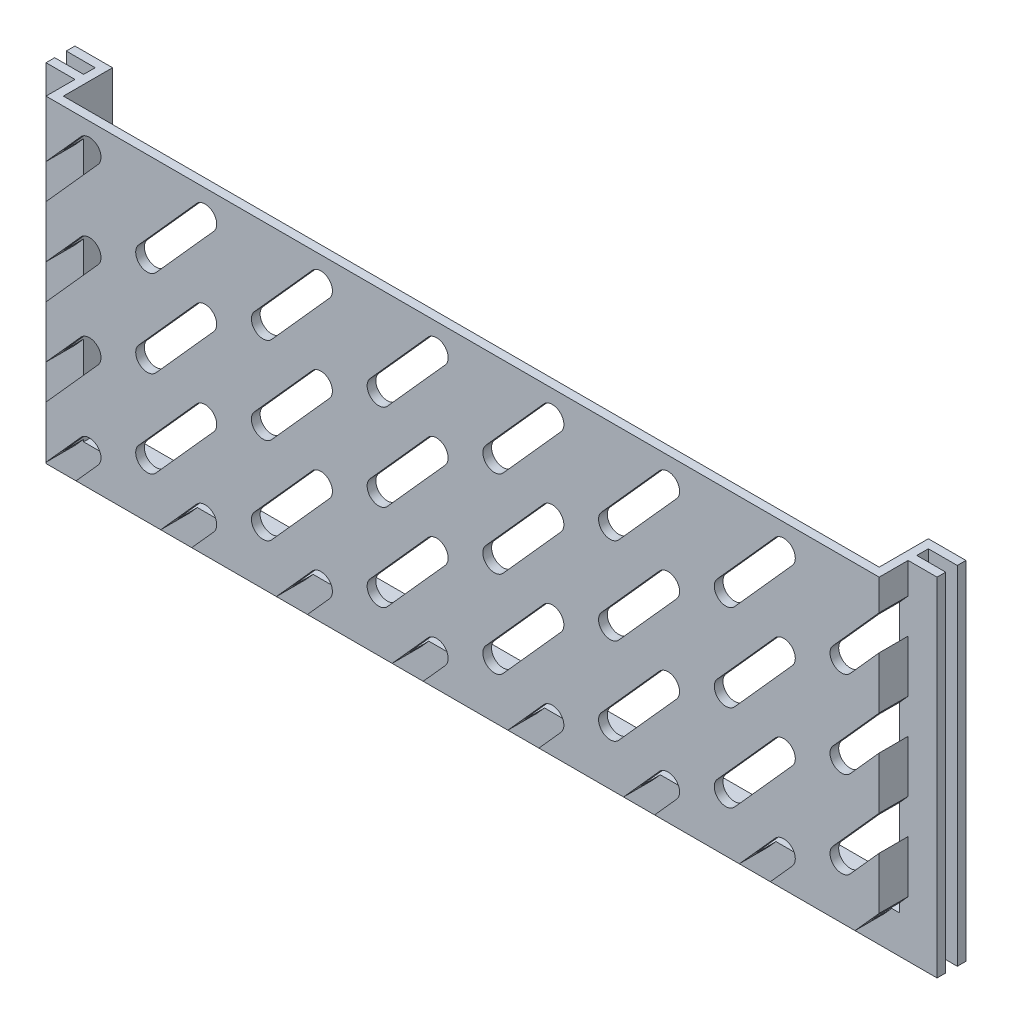
from build123d import *

# Parameters (mm, degrees)
SKETCH1_W               = 288
SKETCH1_H               = 110
BOSS_EXTRUDE2_DEPTH     = 3
BOSS_EXTRUDE3_DEPTH     = 10
BOSS_EXTRUDE4_DEPTH     = 3
BOSS_EXTRUDE5_DEPTH     = 4
BOSS_EXTRUDE6_DEPTH     = 3
CUT_EXTRUDE3_DEPTH      = 169.017856194
CUT_EXTRUDE3_DEPTH_BACK = 7


with BuildPart() as part:
    # Sketch1 → Boss-Extrude2 (new body)
    with BuildSketch(Plane.XY):
        Rectangle(SKETCH1_W, SKETCH1_H)
    extrude(amount=BOSS_EXTRUDE2_DEPTH)

    # Sketch2 → Boss-Extrude3 (add)
    with BuildSketch(Plane(origin=(0, 0, 0), x_dir=(-1, 0, 0), z_dir=(0, 0, -1))):
        Polygon((-144, 55), (-141, 55), (-141, -52), (141, -52), (141, 55), (144, 55), (144, -55), (-144, -55), align=None)
    extrude(amount=BOSS_EXTRUDE3_DEPTH)

    # Sketch3 → Boss-Extrude4 (add)
    with BuildSketch(Plane(origin=(0, 0, -10), x_dir=(-1, 0, 0), z_dir=(0, 0, -1))):
        Polygon((-144, 55), (-144, -55), (144, -55), (144, 55), (154, 55), (154, -65), (-154, -65), (-154, 55), align=None)
    extrude(amount=-BOSS_EXTRUDE4_DEPTH)

    # Sketch4 → Boss-Extrude5 (add)
    with BuildSketch(Plane(origin=(0, 0, -10), x_dir=(-1, 0, 0), z_dir=(0, 0, -1))):
        Polygon((144, 55), (144, -55), (-144, -55), (-144, 55), (-141, 55), (-141, -52), (141, -52), (141, 55), align=None)
    extrude(amount=BOSS_EXTRUDE5_DEPTH)

    # Sketch5 → Boss-Extrude6 (add)
    with BuildSketch(Plane(origin=(0, 0, -14), x_dir=(-1, 0, 0), z_dir=(0, 0, -1))):
        Polygon((-141, -52), (-141, 55), (-154, 55), (-154, -65), (154, -65), (154, 55), (141, 55), (141, -52), align=None)
    extrude(amount=BOSS_EXTRUDE6_DEPTH)

    # Sketch6 → Cut-Extrude3 (cut, two sides: drawn at the far end of the back side and taken through both)
    with BuildSketch(Plane.XY.offset(-CUT_EXTRUDE3_DEPTH_BACK)):
        with BuildLine():
            Line((-151.98142397, 26.486326779), (-131.98142397, 48.847006554))
            ThreePointArc((-131.98142397, 48.847006554), (-126.333333333, 49.161763857), (-126.01857603, 43.513673221))
            Line((-126.01857603, 43.513673221), (-146.01857603, 21.152993446))
            ThreePointArc((-146.01857603, 21.152993446), (-151.666666667, 20.838236143), (-151.98142397, 26.486326779))
        make_face()
        with BuildLine():
            Line((-111.98142397, 26.486326779), (-91.98142397, 48.847006554))
            ThreePointArc((-91.98142397, 48.847006554), (-86.333333333, 49.161763857), (-86.01857603, 43.513673221))
            Line((-86.01857603, 43.513673221), (-106.01857603, 21.152993446))
            ThreePointArc((-106.01857603, 21.152993446), (-111.666666667, 20.838236143), (-111.98142397, 26.486326779))
        make_face()
        with BuildLine():
            Line((-71.98142397, 26.486326779), (-51.98142397, 48.847006554))
            ThreePointArc((-51.98142397, 48.847006554), (-46.333333333, 49.161763857), (-46.01857603, 43.513673221))
            Line((-46.01857603, 43.513673221), (-66.01857603, 21.152993446))
            ThreePointArc((-66.01857603, 21.152993446), (-71.666666667, 20.838236143), (-71.98142397, 26.486326779))
        make_face()
        with BuildLine():
            Line((-31.98142397, 26.486326779), (-11.98142397, 48.847006554))
            ThreePointArc((-11.98142397, 48.847006554), (-6.333333333, 49.161763857), (-6.01857603, 43.513673221))
            Line((-6.01857603, 43.513673221), (-26.01857603, 21.152993446))
            ThreePointArc((-26.01857603, 21.152993446), (-31.666666667, 20.838236143), (-31.98142397, 26.486326779))
        make_face()
        with BuildLine():
            Line((8.01857603, 26.486326779), (28.01857603, 48.847006554))
            ThreePointArc((28.01857603, 48.847006554), (33.666666667, 49.161763857), (33.98142397, 43.513673221))
            Line((33.98142397, 43.513673221), (13.98142397, 21.152993446))
            ThreePointArc((13.98142397, 21.152993446), (8.333333333, 20.838236143), (8.01857603, 26.486326779))
        make_face()
        with BuildLine():
            Line((48.01857603, 26.486326779), (68.01857603, 48.847006554))
            ThreePointArc((68.01857603, 48.847006554), (73.666666667, 49.161763857), (73.98142397, 43.513673221))
            Line((73.98142397, 43.513673221), (53.98142397, 21.152993446))
            ThreePointArc((53.98142397, 21.152993446), (48.333333333, 20.838236143), (48.01857603, 26.486326779))
        make_face()
        with BuildLine():
            Line((88.01857603, 26.486326779), (108.01857603, 48.847006554))
            ThreePointArc((108.01857603, 48.847006554), (113.666666667, 49.161763857), (113.98142397, 43.513673221))
            Line((113.98142397, 43.513673221), (93.98142397, 21.152993446))
            ThreePointArc((93.98142397, 21.152993446), (88.333333333, 20.838236143), (88.01857603, 26.486326779))
        make_face()
        with BuildLine():
            Line((128.01857603, 26.486326779), (148.01857603, 48.847006554))
            ThreePointArc((148.01857603, 48.847006554), (153.666666667, 49.161763857), (153.98142397, 43.513673221))
            Line((153.98142397, 43.513673221), (133.98142397, 21.152993446))
            ThreePointArc((133.98142397, 21.152993446), (128.333333333, 20.838236143), (128.01857603, 26.486326779))
        make_face()
        with BuildLine():
            Line((-111.98142397, -3.513673221), (-91.98142397, 18.847006554))
            ThreePointArc((-91.98142397, 18.847006554), (-86.333333333, 19.161763857), (-86.01857603, 13.513673221))
            Line((-86.01857603, 13.513673221), (-106.01857603, -8.847006554))
            ThreePointArc((-106.01857603, -8.847006554), (-111.666666667, -9.161763857), (-111.98142397, -3.513673221))
        make_face()
        with BuildLine():
            Line((-71.98142397, -3.513673221), (-51.98142397, 18.847006554))
            ThreePointArc((-51.98142397, 18.847006554), (-46.333333333, 19.161763857), (-46.01857603, 13.513673221))
            Line((-46.01857603, 13.513673221), (-66.01857603, -8.847006554))
            ThreePointArc((-66.01857603, -8.847006554), (-71.666666667, -9.161763857), (-71.98142397, -3.513673221))
        make_face()
        with BuildLine():
            Line((-31.98142397, -3.513673221), (-11.98142397, 18.847006554))
            ThreePointArc((-11.98142397, 18.847006554), (-6.333333333, 19.161763857), (-6.01857603, 13.513673221))
            Line((-6.01857603, 13.513673221), (-26.01857603, -8.847006554))
            ThreePointArc((-26.01857603, -8.847006554), (-31.666666667, -9.161763857), (-31.98142397, -3.513673221))
        make_face()
        with BuildLine():
            Line((8.01857603, -3.513673221), (28.01857603, 18.847006554))
            ThreePointArc((28.01857603, 18.847006554), (33.666666667, 19.161763857), (33.98142397, 13.513673221))
            Line((33.98142397, 13.513673221), (13.98142397, -8.847006554))
            ThreePointArc((13.98142397, -8.847006554), (8.333333333, -9.161763857), (8.01857603, -3.513673221))
        make_face()
        with BuildLine():
            Line((48.01857603, -3.513673221), (68.01857603, 18.847006554))
            ThreePointArc((68.01857603, 18.847006554), (73.666666667, 19.161763857), (73.98142397, 13.513673221))
            Line((73.98142397, 13.513673221), (53.98142397, -8.847006554))
            ThreePointArc((53.98142397, -8.847006554), (48.333333333, -9.161763857), (48.01857603, -3.513673221))
        make_face()
        with BuildLine():
            Line((88.01857603, -3.513673221), (108.01857603, 18.847006554))
            ThreePointArc((108.01857603, 18.847006554), (113.666666667, 19.161763857), (113.98142397, 13.513673221))
            Line((113.98142397, 13.513673221), (93.98142397, -8.847006554))
            ThreePointArc((93.98142397, -8.847006554), (88.333333333, -9.161763857), (88.01857603, -3.513673221))
        make_face()
        with BuildLine():
            Line((128.01857603, -3.513673221), (148.01857603, 18.847006554))
            ThreePointArc((148.01857603, 18.847006554), (153.666666667, 19.161763857), (153.98142397, 13.513673221))
            Line((153.98142397, 13.513673221), (133.98142397, -8.847006554))
            ThreePointArc((133.98142397, -8.847006554), (128.333333333, -9.161763857), (128.01857603, -3.513673221))
        make_face()
        with BuildLine():
            Line((-111.98142397, -33.513673221), (-91.98142397, -11.152993446))
            ThreePointArc((-91.98142397, -11.152993446), (-86.333333333, -10.838236143), (-86.01857603, -16.486326779))
            Line((-86.01857603, -16.486326779), (-106.01857603, -38.847006554))
            ThreePointArc((-106.01857603, -38.847006554), (-111.666666667, -39.161763857), (-111.98142397, -33.513673221))
        make_face()
        with BuildLine():
            Line((-71.98142397, -33.513673221), (-51.98142397, -11.152993446))
            ThreePointArc((-51.98142397, -11.152993446), (-46.333333333, -10.838236143), (-46.01857603, -16.486326779))
            Line((-46.01857603, -16.486326779), (-66.01857603, -38.847006554))
            ThreePointArc((-66.01857603, -38.847006554), (-71.666666667, -39.161763857), (-71.98142397, -33.513673221))
        make_face()
        with BuildLine():
            Line((-31.98142397, -33.513673221), (-11.98142397, -11.152993446))
            ThreePointArc((-11.98142397, -11.152993446), (-6.333333333, -10.838236143), (-6.01857603, -16.486326779))
            Line((-6.01857603, -16.486326779), (-26.01857603, -38.847006554))
            ThreePointArc((-26.01857603, -38.847006554), (-31.666666667, -39.161763857), (-31.98142397, -33.513673221))
        make_face()
        with BuildLine():
            Line((8.01857603, -33.513673221), (28.01857603, -11.152993446))
            ThreePointArc((28.01857603, -11.152993446), (33.666666667, -10.838236143), (33.98142397, -16.486326779))
            Line((33.98142397, -16.486326779), (13.98142397, -38.847006554))
            ThreePointArc((13.98142397, -38.847006554), (8.333333333, -39.161763857), (8.01857603, -33.513673221))
        make_face()
        with BuildLine():
            Line((48.01857603, -33.513673221), (68.01857603, -11.152993446))
            ThreePointArc((68.01857603, -11.152993446), (73.666666667, -10.838236143), (73.98142397, -16.486326779))
            Line((73.98142397, -16.486326779), (53.98142397, -38.847006554))
            ThreePointArc((53.98142397, -38.847006554), (48.333333333, -39.161763857), (48.01857603, -33.513673221))
        make_face()
        with BuildLine():
            Line((88.01857603, -33.513673221), (108.01857603, -11.152993446))
            ThreePointArc((108.01857603, -11.152993446), (113.666666667, -10.838236143), (113.98142397, -16.486326779))
            Line((113.98142397, -16.486326779), (93.98142397, -38.847006554))
            ThreePointArc((93.98142397, -38.847006554), (88.333333333, -39.161763857), (88.01857603, -33.513673221))
        make_face()
        with BuildLine():
            Line((128.01857603, -33.513673221), (148.01857603, -11.152993446))
            ThreePointArc((148.01857603, -11.152993446), (153.666666667, -10.838236143), (153.98142397, -16.486326779))
            Line((153.98142397, -16.486326779), (133.98142397, -38.847006554))
            ThreePointArc((133.98142397, -38.847006554), (128.333333333, -39.161763857), (128.01857603, -33.513673221))
        make_face()
        with BuildLine():
            Line((-111.98142397, -63.513673221), (-91.98142397, -41.152993446))
            ThreePointArc((-91.98142397, -41.152993446), (-86.333333333, -40.838236143), (-86.01857603, -46.486326779))
            Line((-86.01857603, -46.486326779), (-106.01857603, -68.847006554))
            ThreePointArc((-106.01857603, -68.847006554), (-111.666666667, -69.161763857), (-111.98142397, -63.513673221))
        make_face()
        with BuildLine():
            Line((-71.98142397, -63.513673221), (-51.98142397, -41.152993446))
            ThreePointArc((-51.98142397, -41.152993446), (-46.333333333, -40.838236143), (-46.01857603, -46.486326779))
            Line((-46.01857603, -46.486326779), (-66.01857603, -68.847006554))
            ThreePointArc((-66.01857603, -68.847006554), (-71.666666667, -69.161763857), (-71.98142397, -63.513673221))
        make_face()
        with BuildLine():
            Line((-31.98142397, -63.513673221), (-11.98142397, -41.152993446))
            ThreePointArc((-11.98142397, -41.152993446), (-6.333333333, -40.838236143), (-6.01857603, -46.486326779))
            Line((-6.01857603, -46.486326779), (-26.01857603, -68.847006554))
            ThreePointArc((-26.01857603, -68.847006554), (-31.666666667, -69.161763857), (-31.98142397, -63.513673221))
        make_face()
        with BuildLine():
            Line((8.01857603, -63.513673221), (28.01857603, -41.152993446))
            ThreePointArc((28.01857603, -41.152993446), (33.666666667, -40.838236143), (33.98142397, -46.486326779))
            Line((33.98142397, -46.486326779), (13.98142397, -68.847006554))
            ThreePointArc((13.98142397, -68.847006554), (8.333333333, -69.161763857), (8.01857603, -63.513673221))
        make_face()
        with BuildLine():
            Line((48.01857603, -63.513673221), (68.01857603, -41.152993446))
            ThreePointArc((68.01857603, -41.152993446), (73.666666667, -40.838236143), (73.98142397, -46.486326779))
            Line((73.98142397, -46.486326779), (53.98142397, -68.847006554))
            ThreePointArc((53.98142397, -68.847006554), (48.333333333, -69.161763857), (48.01857603, -63.513673221))
        make_face()
        with BuildLine():
            Line((88.01857603, -63.513673221), (108.01857603, -41.152993446))
            ThreePointArc((108.01857603, -41.152993446), (113.666666667, -40.838236143), (113.98142397, -46.486326779))
            Line((113.98142397, -46.486326779), (93.98142397, -68.847006554))
            ThreePointArc((93.98142397, -68.847006554), (88.333333333, -69.161763857), (88.01857603, -63.513673221))
        make_face()
        with BuildLine():
            Line((128.01857603, -63.513673221), (148.01857603, -41.152993446))
            ThreePointArc((148.01857603, -41.152993446), (153.666666667, -40.838236143), (153.98142397, -46.486326779))
            Line((153.98142397, -46.486326779), (133.98142397, -68.847006554))
            ThreePointArc((133.98142397, -68.847006554), (128.333333333, -69.161763857), (128.01857603, -63.513673221))
        make_face()
        with BuildLine():
            Line((-151.98142397, -3.513673221), (-131.98142397, 18.847006554))
            ThreePointArc((-131.98142397, 18.847006554), (-126.333333333, 19.161763857), (-126.01857603, 13.513673221))
            Line((-126.01857603, 13.513673221), (-146.01857603, -8.847006554))
            ThreePointArc((-146.01857603, -8.847006554), (-151.666666667, -9.161763857), (-151.98142397, -3.513673221))
        make_face()
        with BuildLine():
            Line((-151.98142397, -33.513673221), (-131.98142397, -11.152993446))
            ThreePointArc((-131.98142397, -11.152993446), (-126.333333333, -10.838236143), (-126.01857603, -16.486326779))
            Line((-126.01857603, -16.486326779), (-146.01857603, -38.847006554))
            ThreePointArc((-146.01857603, -38.847006554), (-151.666666667, -39.161763857), (-151.98142397, -33.513673221))
        make_face()
        with BuildLine():
            Line((-151.98142397, -63.513673221), (-131.98142397, -41.152993446))
            ThreePointArc((-131.98142397, -41.152993446), (-126.333333333, -40.838236143), (-126.01857603, -46.486326779))
            Line((-126.01857603, -46.486326779), (-146.01857603, -68.847006554))
            ThreePointArc((-146.01857603, -68.847006554), (-151.666666667, -69.161763857), (-151.98142397, -63.513673221))
        make_face()
    extrude(amount=CUT_EXTRUDE3_DEPTH + CUT_EXTRUDE3_DEPTH_BACK, mode=Mode.SUBTRACT)


solid = part.part
